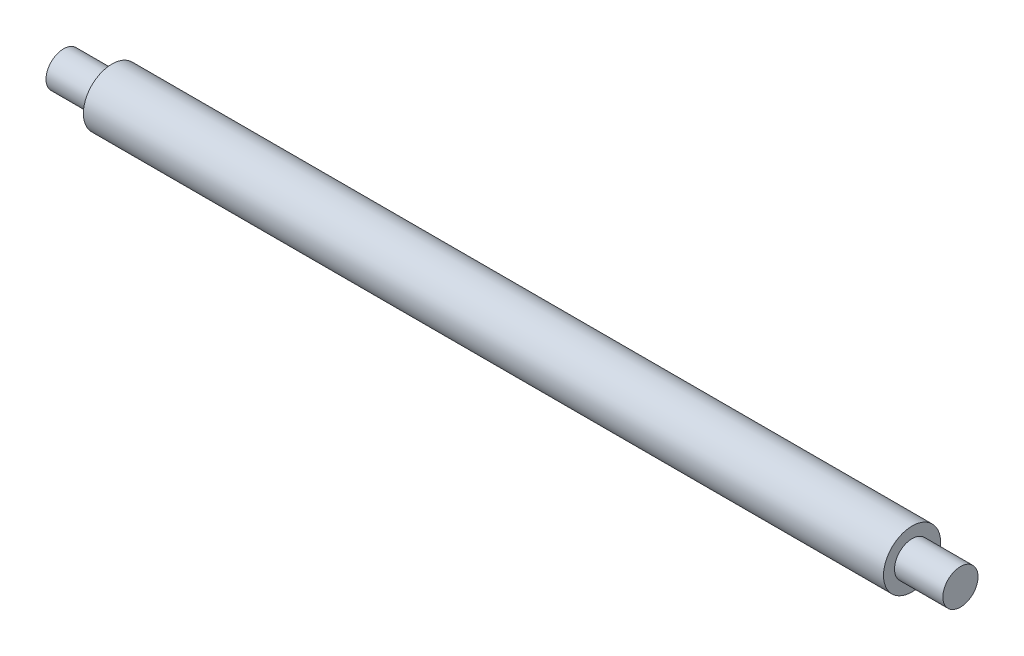
from build123d import *


with BuildPart() as part:
    # Sketch1 → Revolve1 (revolve)
    with BuildSketch(Plane.XY, mode=Mode.PRIVATE) as revolve1_sk:
        Polygon((0, 0), (204, 0), (204, 4), (193, 4), (193, 6.5), (11, 6.5), (11, 4), (0, 4), align=None)
    revolve(revolve1_sk.sketch.rotate(Axis((0, 0, 0), (1, 0, 0)), 90), axis=Axis((0, 0, 0), (1, 0, 0)))


solid = part.part
